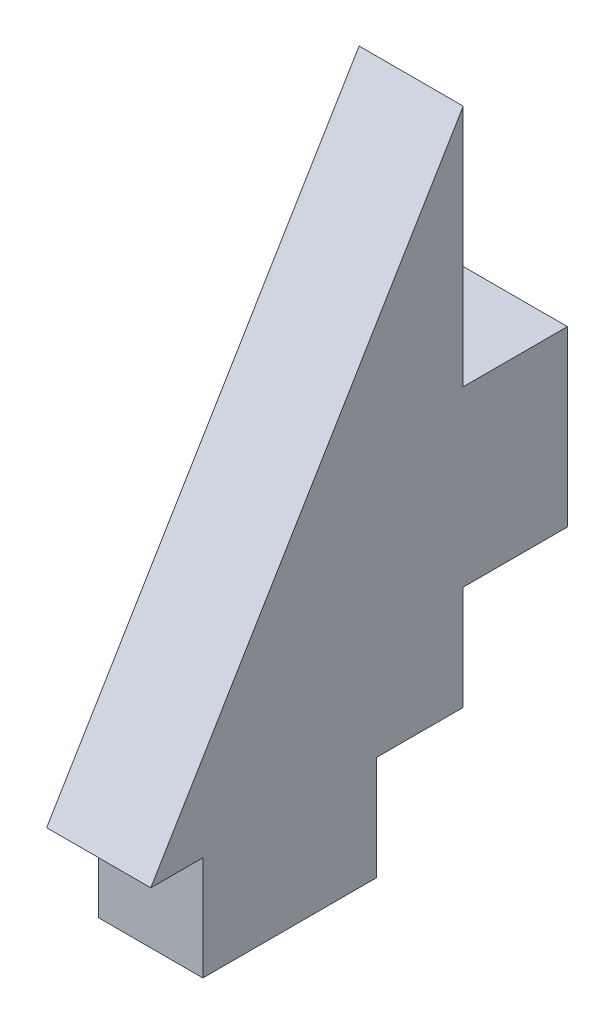
from build123d import *

# Parameters (mm, degrees)
SKETCH1_W           = 5
SKETCH1_H           = 3
SKETCH1_W_2         = 3
SKETCH1_H_2         = 5
BOSS_EXTRUDE1_DEPTH = 3


with BuildPart() as part:
    # Sketch1 → Boss-Extrude1 (new body)
    with BuildSketch(Plane(origin=(0, 0, 0), x_dir=(0, 0, -1), z_dir=(1, 0, 0))):
        Polygon((0, 0), (-9, 0), (0, 15), align=None)
        with Locations((-5, -1.5)):
            Rectangle(SKETCH1_W, SKETCH1_H)
        with Locations((1.5, 5.5)):
            Rectangle(SKETCH1_W_2, SKETCH1_H_2)
    extrude(amount=BOSS_EXTRUDE1_DEPTH)


solid = part.part
